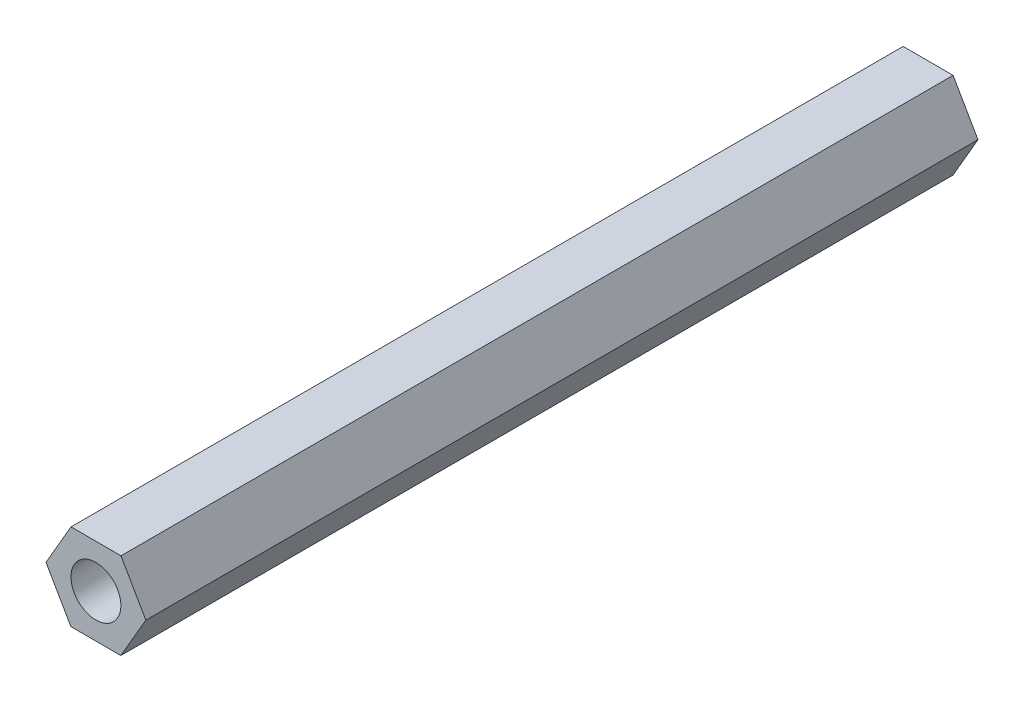
from build123d import *

# Parameters (mm, degrees)
SKETCH_1_W      = 1
SKETCH_1_H      = 50
SKETCH_5_R      = 1.5
EXTRUDE_4_DEPTH = 50


with BuildPart() as part:
    # 草图1 → 旋转1 (revolve)
    with BuildSketch(Plane.XZ, mode=Mode.PRIVATE) as revolve_1_sk:
        with Locations((2, 25)):
            Rectangle(SKETCH_1_W, SKETCH_1_H)
    revolve(revolve_1_sk.sketch.rotate(Axis((0, 0, 50), (0, 0, -1)), 180), axis=Axis((0, 0, 50), (0, 0, -1)))

    # 草图5 → 凸台-拉伸4 (add)
    with BuildSketch(Plane(origin=(0, 0, 0), x_dir=(-1, 0, 0), z_dir=(0, 0, -1))):
        Polygon((-1.504244122, 2.59562124), (-2.999995993, -0.004903003), (-1.495751872, -2.600524243), (1.504244122, -2.59562124), (2.999995993, 0.004903003), (1.495751872, 2.600524243), align=None)
        Circle(SKETCH_5_R, mode=Mode.SUBTRACT)
    extrude(amount=-EXTRUDE_4_DEPTH)


solid = part.part
